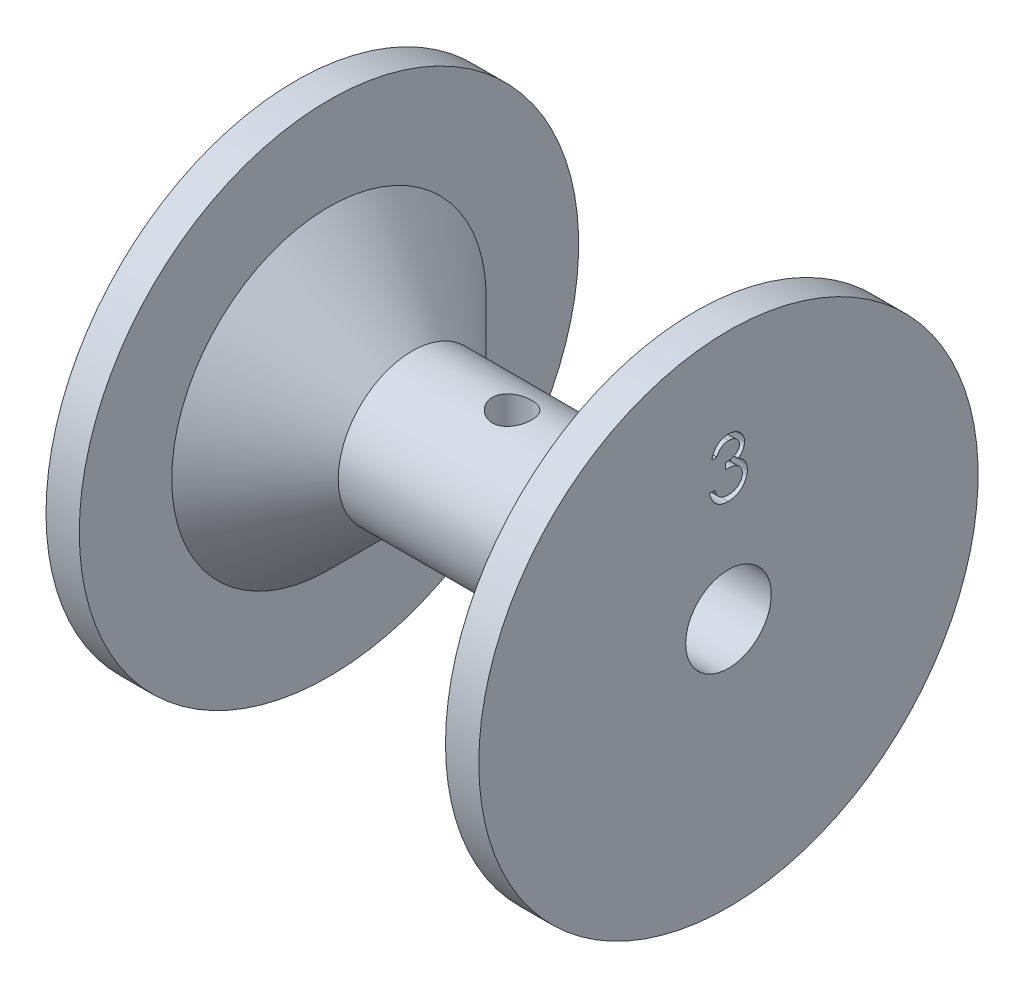
from build123d import *

# Parameters (mm, degrees)
CUT_EXTRUDE1_DEPTH      = 32.597232474
CUT_EXTRUDE1_DEPTH_BACK = 32.597232474
SKETCH2_R               = 1.5
CUT_EXTRUDE2_DEPTH      = 1.27
CHAMFER1_SIZE           = 6.35


with BuildPart() as part:
    # Sketch1 → Revolve1 (revolve)
    with BuildSketch(Plane.XY):
        Polygon((16.51, 3.2639), (16.51, 19.05), (13.97, 19.05), (13.97, 5.64515), (-13.97, 5.64515), (-13.97, 19.05), (-16.51, 19.05), (-16.51, 3.2639), align=None)
    revolve(axis=Axis((-15.275524476, 0, 0), (1, 0, 0)))

    # Sketch2 → Cut-Extrude1 (cut, two sides: drawn at the far end of the back side and taken through both)
    with BuildSketch(Plane(origin=(0, 0, 0), x_dir=(1, 0, 0), z_dir=(0, 1, 0)).offset(-CUT_EXTRUDE1_DEPTH_BACK)):
        Circle(SKETCH2_R)
    extrude(amount=CUT_EXTRUDE1_DEPTH + CUT_EXTRUDE1_DEPTH_BACK, mode=Mode.SUBTRACT)

    # Sketch3 → Cut-Extrude2 (cut)
    with BuildSketch(Plane(origin=(16.51, 0, 0), x_dir=(0, 0, -1), z_dir=(1, 0, 0))):
        with BuildLine():
            Line((-0.892975977, 11.138058786), (-1.272890507, 11.138058786))
            add(Edge.make_bspline(
                [(-1.272890507, 11.138058786), (-1.262598003, 11.180673314), (-1.242476999, 11.263981231), (-1.200509458, 11.383007156), (-1.154790359, 11.495642272), (-1.099891156, 11.599777524), (-1.040009139, 11.69750572), (-0.971401657, 11.78661028), (-0.897233992, 11.869357391), (-0.815198101, 11.942791497), (-0.729166292, 12.00928837), (-0.637926323, 12.065984868), (-0.543313871, 12.114757891), (-0.444673415, 12.154938552), (-0.341711283, 12.185207519), (-0.23535831, 12.207168607), (-0.125335791, 12.221430241), (-0.05065061, 12.222822116), (-0.01272758, 12.223528871)],
                knots=[0, 0, 0, 0, 1.162005537, 2.271625781, 3.343758855, 4.383309926, 5.390229558, 6.379919256, 7.361854164, 8.333198761, 9.295911338, 10.242430842, 11.177959212, 12.116337295, 13.062827104, 14.020064771, 14.994644689, 16, 16, 16, 16], degree=3))
            add(Edge.make_bspline(
                [(-0.01272758, 12.223528871), (0.042526785, 12.221860659), (0.151830255, 12.218560624), (0.312410321, 12.18842602), (0.467261807, 12.140740384), (0.614689755, 12.074853114), (0.751630144, 11.993588459), (0.873472961, 11.896869206), (0.978566683, 11.786561479), (1.066734169, 11.664723044), (1.135767739, 11.534511142), (1.18667221, 11.400495714), (1.217662243, 11.262994663), (1.221678536, 11.170154906), (1.22369069, 11.123642386)],
                knots=[0, 0, 0, 0, 1.083050992, 2.142477498, 3.193116406, 4.255571735, 5.30263384, 6.308962982, 7.297363603, 8.282367274, 9.249857812, 10.179914175, 11.08814088, 12, 12, 12, 12], degree=3))
            add(Edge.make_bspline(
                [(1.22369069, 11.123642386), (1.222283298, 11.078881787), (1.219529252, 10.99129224), (1.196144675, 10.863419572), (1.156791291, 10.742900684), (1.10227834, 10.629228231), (1.031712846, 10.523122948), (0.946232536, 10.424346109), (0.845234078, 10.332459603), (0.768696696, 10.279821765), (0.729292987, 10.252722247)],
                knots=[0, 0, 0, 0, 1.024540389, 2.004866551, 2.965041327, 3.920577974, 4.882998113, 5.874504559, 6.905732034, 8, 8, 8, 8], degree=3))
            add(Edge.make_bspline(
                [(0.729292987, 10.252722247), (0.77432568, 10.230977221), (0.863548471, 10.187894034), (0.98516673, 10.103401832), (1.095569494, 10.005846059), (1.157138754, 9.929715422), (1.188073702, 9.891464234)],
                knots=[0, 0, 0, 0, 1.015518401, 2.012035669, 3.001164323, 4, 4, 4, 4], degree=3))
            add(Edge.make_bspline(
                [(1.188073702, 9.891464234), (1.208443707, 9.863575335), (1.248850143, 9.808254236), (1.298725503, 9.719310178), (1.343972717, 9.629380281), (1.379230602, 9.536054143), (1.406534231, 9.44041345), (1.426051146, 9.34229398), (1.438175583, 9.24161561), (1.439911918, 9.173504325), (1.440784707, 9.139267386)],
                knots=[0, 0, 0, 0, 1.025084078, 2.033381695, 3.024893161, 4.013698104, 4.991890475, 5.976764909, 6.982997093, 8, 8, 8, 8], degree=3))
            add(Edge.make_bspline(
                [(1.440784707, 9.139267386), (1.4386142, 9.079988962), (1.434283401, 8.961711077), (1.395573711, 8.786965462), (1.335565315, 8.616149854), (1.250345973, 8.45277362), (1.146487177, 8.29991354), (1.022925461, 8.163145052), (0.881064757, 8.045581026), (0.722852211, 7.947355321), (0.55144197, 7.868835549), (0.368107682, 7.814337499), (0.17549095, 7.778842814), (0.043402124, 7.775036601), (-0.023751885, 7.773101521)],
                knots=[0, 0, 0, 0, 0.955779014, 1.907060117, 2.875433937, 3.871313158, 4.872415639, 5.851225146, 6.836215519, 7.83643374, 8.849228613, 9.86973379, 10.916971861, 12, 12, 12, 12], degree=3))
            add(Edge.make_bspline(
                [(-0.023751885, 7.773101521), (-0.06901142, 7.774151645), (-0.158067092, 7.77621794), (-0.28899018, 7.790343487), (-0.413960236, 7.816142636), (-0.533146225, 7.850859967), (-0.646654031, 7.894876646), (-0.754137282, 7.94969069), (-0.856257249, 8.014172221), (-0.952050266, 8.08908237), (-1.041504915, 8.1728798), (-1.122243924, 8.267052126), (-1.195613388, 8.36985851), (-1.25964877, 8.482493064), (-1.317266798, 8.603500185), (-1.364657098, 8.734429321), (-1.406368214, 8.874109995), (-1.425761071, 8.971449738), (-1.43571102, 9.021392119)],
                knots=[0, 0, 0, 0, 1.048658725, 2.063410685, 3.046034179, 4.001477787, 4.936774919, 5.862367409, 6.792675028, 7.730719943, 8.675894397, 9.627829632, 10.600096036, 11.597688215, 12.626045268, 13.701542398, 14.82072376, 16, 16, 16, 16], degree=3))
            Line((-1.43571102, 9.021392119), (-1.05579649, 9.021392119))
            add(Edge.make_bspline(
                [(-1.05579649, 9.021392119), (-1.045898604, 8.988796646), (-1.026646356, 8.925395619), (-0.993875158, 8.834148773), (-0.956539248, 8.750500461), (-0.916486401, 8.673837066), (-0.874421042, 8.603403589), (-0.827352514, 8.541062471), (-0.778766976, 8.484075512), (-0.742143377, 8.451969172), (-0.7242193, 8.436255901)],
                knots=[0, 0, 0, 0, 1.198163088, 2.33053128, 3.407730985, 4.417276592, 5.372219308, 6.28897303, 7.162600585, 8, 8, 8, 8], degree=3))
            add(Edge.make_bspline(
                [(-0.7242193, 8.436255901), (-0.700516774, 8.417982012), (-0.653184886, 8.38149064), (-0.576055693, 8.334922003), (-0.494939116, 8.294571049), (-0.408077558, 8.263747912), (-0.317345407, 8.237649218), (-0.221276117, 8.220570114), (-0.120717255, 8.20885204), (-0.052055293, 8.20781798), (-0.016967697, 8.207289555)],
                knots=[0, 0, 0, 0, 0.946170439, 1.889420265, 2.845303464, 3.807233317, 4.801018734, 5.828864929, 6.890507805, 8, 8, 8, 8], degree=3))
            add(Edge.make_bspline(
                [(-0.016967697, 8.207289555), (0.022648444, 8.208034507), (0.100114388, 8.209491196), (0.213150266, 8.222887528), (0.320685941, 8.242397647), (0.421527479, 8.272530493), (0.516995807, 8.309760665), (0.60575266, 8.356506832), (0.688963188, 8.411352352), (0.765561612, 8.473690192), (0.834438559, 8.541933334), (0.895083494, 8.613311048), (0.946639037, 8.687522385), (0.988226794, 8.764978017), (1.021066031, 8.845357198), (1.043421902, 8.928885497), (1.058966115, 9.014879333), (1.060232018, 9.073334372), (1.060870177, 9.102802376)],
                knots=[0, 0, 0, 0, 1.217147791, 2.380027433, 3.494444702, 4.572153297, 5.609568379, 6.639424714, 7.649109417, 8.668170816, 9.669597737, 10.625200337, 11.543417969, 12.441394052, 13.322311151, 14.205496177, 15.095365482, 16, 16, 16, 16], degree=3))
            add(Edge.make_bspline(
                [(1.060870177, 9.102802376), (1.059019241, 9.142246566), (1.055326578, 9.220938679), (1.027134296, 9.336711364), (0.980762527, 9.448257777), (0.915844347, 9.553674781), (0.836819228, 9.651375157), (0.744454055, 9.738547331), (0.637981816, 9.810477822), (0.539986356, 9.86017553), (0.45318469, 9.89408704), (0.378901321, 9.916674854), (0.295738572, 9.935801847), (0.204702131, 9.95359669), (0.10510605, 9.968741559), (-0.002941242, 9.981371183), (-0.119461639, 9.991476804), (-0.200126192, 9.995989653), (-0.241693926, 9.998315196)],
                knots=[0, 0, 0, 0, 1.07054697, 2.135767047, 3.216561865, 4.33974944, 5.486079747, 6.621378074, 7.775625952, 8.963672916, 9.598146892, 10.304877434, 11.070270905, 11.915000392, 12.823868403, 13.805723172, 14.86925407, 16, 16, 16, 16], degree=3))
            Line((-0.241693926, 9.998315196), (-0.241693926, 10.43250323))
            add(Edge.make_bspline(
                [(-0.241693926, 10.43250323), (-0.189320135, 10.433391993), (-0.086732744, 10.43513286), (0.063120367, 10.456188263), (0.206416659, 10.485314356), (0.339980433, 10.529927875), (0.461717448, 10.581744234), (0.567332586, 10.642041668), (0.655346183, 10.709067127), (0.725330526, 10.78385514), (0.777980165, 10.864064769), (0.816475434, 10.947663012), (0.839214876, 11.03538259), (0.842250378, 11.09524757), (0.84377616, 11.125338433)],
                knots=[0, 0, 0, 0, 1.321986639, 2.589447074, 3.816329219, 5.01088745, 6.139805852, 7.153945165, 8.075214402, 8.924034688, 9.728124013, 10.488707548, 11.240355623, 12, 12, 12, 12], degree=3))
            add(Edge.make_bspline(
                [(0.84377616, 11.125338433), (0.84327492, 11.147445801), (0.842277727, 11.191427361), (0.829701972, 11.255683397), (0.810804322, 11.317975017), (0.784824078, 11.378037321), (0.750050028, 11.435453747), (0.708435168, 11.490713805), (0.658883276, 11.543501994), (0.60210164, 11.592705809), (0.541127361, 11.639598125), (0.474301443, 11.679407952), (0.403638794, 11.713450075), (0.329061183, 11.741522521), (0.250326589, 11.762639945), (0.167804944, 11.777802344), (0.081338888, 11.787282174), (0.022348317, 11.78864702), (-0.007639439, 11.789340837)],
                knots=[0, 0, 0, 0, 0.884392785, 1.759457502, 2.611959086, 3.489218968, 4.37281399, 5.2945488, 6.255912374, 7.266815255, 8.301784654, 9.332968512, 10.37626691, 11.440494194, 12.520033166, 13.637162961, 14.798855837, 16, 16, 16, 16], degree=3))
            add(Edge.make_bspline(
                [(-0.007639439, 11.789340837), (-0.05584098, 11.787657952), (-0.149989801, 11.784370885), (-0.285716415, 11.755580573), (-0.411893133, 11.709645177), (-0.508338949, 11.654813811), (-0.579558824, 11.600687096), (-0.630451883, 11.553416019), (-0.680430024, 11.500882984), (-0.726205271, 11.439852378), (-0.772498557, 11.374457308), (-0.814643884, 11.301373427), (-0.855597988, 11.222507159), (-0.880275358, 11.166753392), (-0.892975977, 11.138058786)],
                knots=[0, 0, 0, 0, 1.472543308, 2.876219568, 4.221790263, 5.565193594, 6.249813518, 6.953379497, 7.687249741, 8.463570142, 9.283606569, 10.136032583, 11.040678096, 12, 12, 12, 12], degree=3))
        make_face()
    extrude(amount=-CUT_EXTRUDE2_DEPTH, mode=Mode.SUBTRACT)

    # Chamfer1
    chamfer1_edges = [part.edges().sort_by_distance(p)[0] for p in [
        (13.97, -5.64515, 0),
        (-13.97, -5.64515, 0),
    ]]
    chamfer(chamfer1_edges, length=CHAMFER1_SIZE)


solid = part.part
